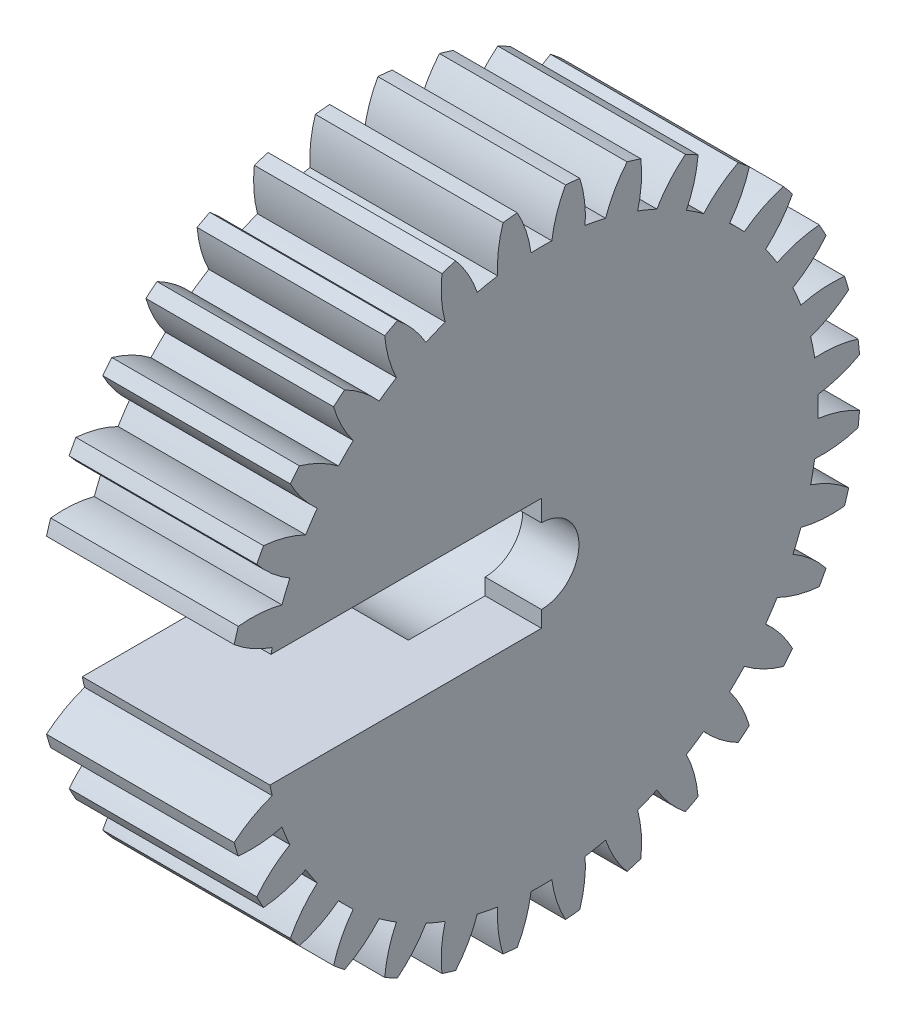
from build123d import *

# Parameters (mm, degrees)
BASPROSKE_W             = 5
BASPROSKE_H             = 8.5
TOOTHCUT_DEPTH          = 14.019216566
TEETHCUTS_COUNT         = 32
TEETHCUTS_ANGLE         = 348.75
BORSKE_R                = 1
BORE_DEPTH              = 50.0000508
CUT_EXTRUDE1_DEPTH      = 13.987467398
CUT_EXTRUDE1_DEPTH_BACK = 13.987467398
SKETCH1_W               = 10
SKETCH1_H               = 3
SKETCH2_R               = 2.5
CUT_EXTRUDE2_DEPTH      = 3.5


with BuildPart() as part:
    # BasProSke → Base-Revolve (revolve)
    with BuildSketch(Plane(origin=(0, 0, 0), x_dir=(1, 0, 0), z_dir=(0, 1, 0)), mode=Mode.PRIVATE) as base_revolve_sk:
        with Locations((2.5, 4.25)):
            Rectangle(BASPROSKE_W, BASPROSKE_H)
    revolve(base_revolve_sk.sketch.rotate(Axis((-10, 0, 0), (1, 0, 0)), 180), axis=Axis((-10, 0, 0), (1, 0, 0)))

    # TooCutSke → ToothCut (cut, through all)
    with BuildSketch(Plane(origin=(0, 0, 0), x_dir=(0, 0, -1), z_dir=(1, 0, 0))):
        with BuildLine():
            ThreePointArc((0.277002447, 7.3687954), (0, 7.374), (-0.277002447, 7.3687954))
            ThreePointArc((-0.277002447, 7.3687954), (-0.41335061, 7.952280695), (-0.656086882, 8.500117362))
            ThreePointArc((-0.656086882, 8.500117362), (0, 8.5254), (0.656086882, 8.500117362))
            ThreePointArc((0.656086882, 8.500117362), (0.41335061, 7.952280695), (0.277002447, 7.3687954))
        make_face()
    toothcut = extrude(amount=TOOTHCUT_DEPTH, mode=Mode.SUBTRACT)

    # TeethCuts: ToothCut ×32 about axis
    teethcuts_axis = Axis((-10, 0, 0), (1, 0, 0))
    for i in range(1, TEETHCUTS_COUNT):
        add(toothcut.rotate(teethcuts_axis, i * TEETHCUTS_ANGLE / (TEETHCUTS_COUNT - 1)), mode=Mode.SUBTRACT)

    # BorSke → Bore (cut, symmetric)
    with BuildSketch(Plane(origin=(0, 0, 0), x_dir=(0, 0, -1), z_dir=(1, 0, 0))):
        with Locations(Location((0, 0, 0), (0, 0, 180))):
            Circle(BORSKE_R)
    extrude(amount=BORE_DEPTH, both=True, mode=Mode.SUBTRACT)

    # Sketch1 → Cut-Extrude1 (cut, two sides: drawn at the far end of the back side and taken through both)
    with BuildSketch(Plane(origin=(5, 0, 0), x_dir=(0, 0, -1), z_dir=(1, 0, 0)).offset(-CUT_EXTRUDE1_DEPTH_BACK)):
        with Locations((-5, 0.065617364)):
            Rectangle(SKETCH1_W, SKETCH1_H)
    extrude(amount=CUT_EXTRUDE1_DEPTH + CUT_EXTRUDE1_DEPTH_BACK, mode=Mode.SUBTRACT)

    # Sketch2 → Cut-Extrude2 (cut)
    with BuildSketch(Plane.ZY):
        Circle(SKETCH2_R)
    extrude(amount=-CUT_EXTRUDE2_DEPTH, mode=Mode.SUBTRACT)


solid = part.part
